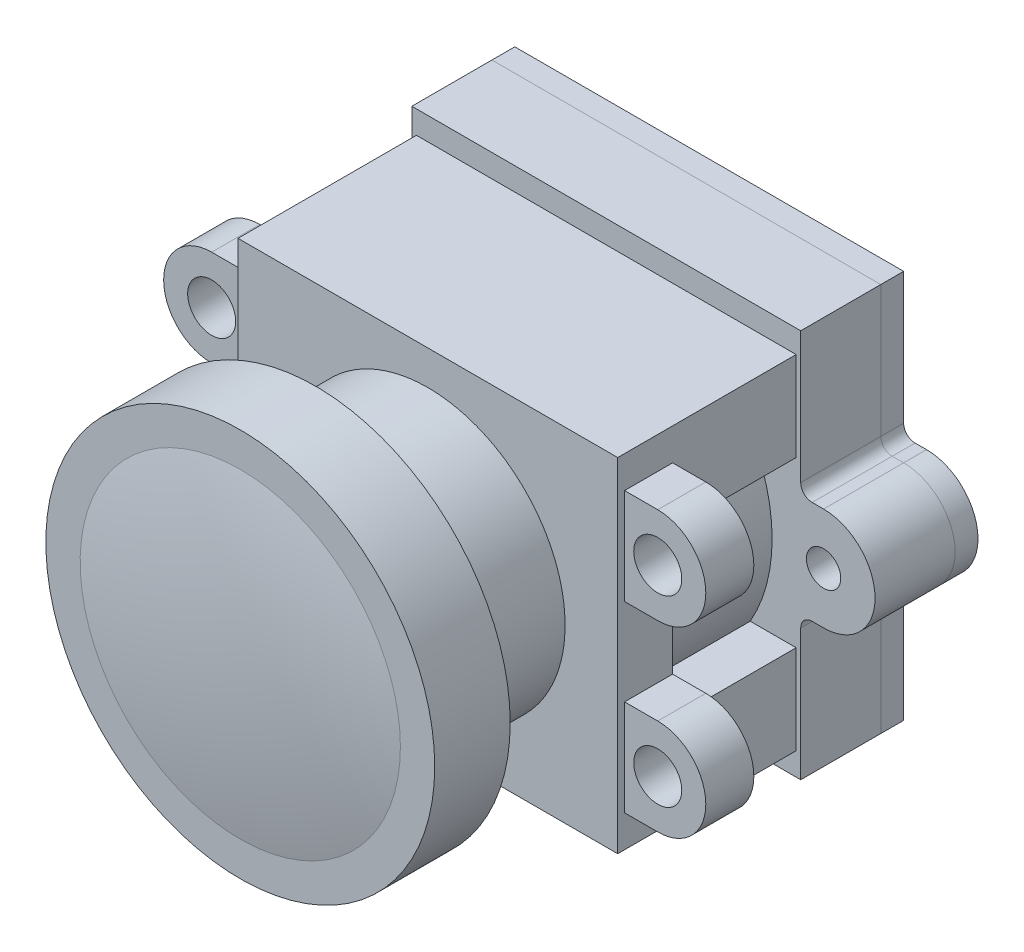
from build123d import *

# Parameters (mm, degrees)
EXTRUDE_START       = -5.1
SKETCH_2_W          = 16.6
SKETCH_2_H          = 15
SKETCH_2_R          = 6
EXTRUDE_1_DEPTH     = 7.8
EXTRUDE_START_2     = -0.3
SKETCH_3_R          = 1.05
EXTRUDE_2_DEPTH     = 2.1
SKETCH_4_R          = 0.75
EXTRUDE_3_DEPTH     = 3.5
SKETCH_5_R          = 0.75
EXTRUDE_4_DEPTH     = 1
CUT_EXTRUDE_1_DEPTH = 5.4


with BuildPart() as part:
    # Эскиз1 → Повернуть1 (revolve)
    with BuildSketch(Plane(origin=(0, 0, 0), x_dir=(0, 0, -1), z_dir=(1, 0, 0)), mode=Mode.PRIVATE) as revolve_1_sk:
        with BuildLine():
            Line((10, 6), (0, 6))
            Line((0, 6), (0, 8.5))
            Line((0, 8.5), (-3.3, 8.5))
            Line((-3.3, 8.5), (-3.3, 7))
            ThreePointArc((-3.3, 7), (-3.824564674, 3.517456467), (-4, 0))
            Line((-4, 0), (0, 0))
            Line((0, 0), (10, 0))
            Line((10, 0), (10, 6))
        make_face()
    revolve(revolve_1_sk.sketch.rotate(Axis((0, 0, 4), (0, 0, -1)), 90), axis=Axis((0, 0, 4), (0, 0, -1)))


with BuildPart() as body_2:
    # Эскиз2 → Бобышка-Вытянуть1 (new body)
    with BuildSketch(Plane(origin=(0, 0, -10), x_dir=(-1, 0, 0), z_dir=(0, 0, -1)).offset(EXTRUDE_START)):
        Rectangle(SKETCH_2_W, SKETCH_2_H)
        Circle(SKETCH_2_R, mode=Mode.SUBTRACT)
    extrude(amount=EXTRUDE_1_DEPTH)

    # Эскиз3 → Бобышка-Вытянуть2 (add)
    # profile 1 of 4: a face of its own
    with BuildSketch(Plane.XY.offset(-4.9).offset(EXTRUDE_START_2)):
        with BuildLine():
            Line((-9.75, 6.1), (-8.3, 6.1))
            Line((-8.3, 6.1), (-8.3, 1.9))
            Line((-8.3, 1.9), (-9.75, 1.9))
            ThreePointArc((-9.75, 1.9), (-11.85, 4), (-9.75, 6.1))
        make_face()
        with Locations((-9.75, 4)):
            Circle(SKETCH_3_R, mode=Mode.SUBTRACT)
    # profile 2 of 4: a face of its own
    with BuildSketch(Plane.XY.offset(-4.9).offset(EXTRUDE_START_2)):
        with BuildLine():
            Line((9.75, 1.9), (8.3, 1.9))
            Line((8.3, 1.9), (8.3, 6.1))
            Line((8.3, 6.1), (9.75, 6.1))
            ThreePointArc((9.75, 6.1), (11.85, 4), (9.75, 1.9))
        make_face()
        with Locations(Location((9.75, 4, 0), (0, 0, 180))):
            Circle(SKETCH_3_R, mode=Mode.SUBTRACT)
    # profile 3 of 4: a face of its own
    with BuildSketch(Plane.XY.offset(-4.9).offset(EXTRUDE_START_2)):
        with BuildLine():
            Line((9.75, -6.1), (8.3, -6.1))
            Line((8.3, -6.1), (8.3, -1.9))
            Line((8.3, -1.9), (9.75, -1.9))
            ThreePointArc((9.75, -1.9), (11.85, -4), (9.75, -6.1))
        make_face()
        with Locations((9.75, -4)):
            Circle(SKETCH_3_R, mode=Mode.SUBTRACT)
    # profile 4 of 4: a face of its own
    with BuildSketch(Plane.XY.offset(-4.9).offset(EXTRUDE_START_2)):
        with BuildLine():
            Line((-9.75, -1.9), (-8.3, -1.9))
            Line((-8.3, -1.9), (-8.3, -6.1))
            Line((-8.3, -6.1), (-9.75, -6.1))
            ThreePointArc((-9.75, -6.1), (-11.85, -4), (-9.75, -1.9))
        make_face()
        with Locations(Location((-9.75, -4, 0), (0, 0, 180))):
            Circle(SKETCH_3_R, mode=Mode.SUBTRACT)
    extrude(amount=-EXTRUDE_2_DEPTH)

    # Эскиз4 → Бобышка-Вытянуть3 (add)
    with BuildSketch(Plane(origin=(0, 0, -12.7), x_dir=(-1, 0, 0), z_dir=(0, 0, -1))):
        with BuildLine():
            Line((-8.5, -8.5), (8.5, -8.5))
            Line((8.5, -8.5), (8.5, -2.75))
            ThreePointArc((8.5, -2.75), (8.646446609, -2.396446609), (9, -2.25))
            Line((9, -2.25), (9.5, -2.25))
            ThreePointArc((9.5, -2.25), (11.75, 0), (9.5, 2.25))
            Line((9.5, 2.25), (9, 2.25))
            ThreePointArc((9, 2.25), (8.646446609, 2.396446609), (8.5, 2.75))
            Line((8.5, 2.75), (8.5, 8.5))
            Line((8.5, 8.5), (-8.5, 8.5))
            Line((-8.5, 8.5), (-8.5, 2.75))
            ThreePointArc((-8.5, 2.75), (-8.646446609, 2.396446609), (-9, 2.25))
            Line((-9, 2.25), (-9.5, 2.25))
            ThreePointArc((-9.5, 2.25), (-11.75, 0), (-9.5, -2.25))
            Line((-9.5, -2.25), (-9, -2.25))
            ThreePointArc((-9, -2.25), (-8.646446609, -2.396446609), (-8.5, -2.75))
            Line((-8.5, -2.75), (-8.5, -8.5))
        make_face()
        with Locations((-9.5, 0)):
            Circle(SKETCH_4_R, mode=Mode.SUBTRACT)
        with Locations(Location((9.5, 0, 0), (0, 0, 180))):
            Circle(SKETCH_4_R, mode=Mode.SUBTRACT)
    extrude(amount=EXTRUDE_3_DEPTH)

    # Эскиз7 → Вырез-Вытянуть1 (cut)
    with BuildSketch(Plane.XY.offset(-12.7)):
        with BuildLine():
            Line((-8.3, -3.6), (-8.3, 3.6))
            Line((-8.3, 3.6), (-6.293051724, 3.6))
            ThreePointArc((-6.293051724, 3.6), (-7.25, 0), (-6.293051724, -3.6))
            Line((-6.293051724, -3.6), (-8.3, -3.6))
        make_face()
        with BuildLine():
            Line((8.3, 3.6), (6.293051724, 3.6))
            ThreePointArc((6.293051724, 3.6), (7.25, 0), (6.293051724, -3.6))
            Line((6.293051724, -3.6), (8.3, -3.6))
            Line((8.3, -3.6), (8.3, 3.6))
        make_face()
    extrude(amount=CUT_EXTRUDE_1_DEPTH, mode=Mode.SUBTRACT)


with BuildPart() as body_3:
    # Эскиз5 → Бобышка-Вытянуть4 (new body)
    with BuildSketch(Plane(origin=(0, 0, -16.2), x_dir=(-1, 0, 0), z_dir=(0, 0, -1))):
        with BuildLine():
            Line((8.5, 2.75), (8.5, 8.5))
            Line((8.5, 8.5), (-8.5, 8.5))
            Line((-8.5, 8.5), (-8.5, 2.75))
            ThreePointArc((-8.5, 2.75), (-8.646446609, 2.396446609), (-9, 2.25))
            Line((-9, 2.25), (-9.5, 2.25))
            ThreePointArc((-9.5, 2.25), (-11.75, 0), (-9.5, -2.25))
            Line((-9.5, -2.25), (-9, -2.25))
            ThreePointArc((-9, -2.25), (-8.646446609, -2.396446609), (-8.5, -2.75))
            Line((-8.5, -2.75), (-8.5, -8.5))
            Line((-8.5, -8.5), (8.5, -8.5))
            Line((8.5, -8.5), (8.5, -2.75))
            ThreePointArc((8.5, -2.75), (8.646446609, -2.396446609), (9, -2.25))
            Line((9, -2.25), (9.5, -2.25))
            ThreePointArc((9.5, -2.25), (11.75, 0), (9.5, 2.25))
            Line((9.5, 2.25), (9, 2.25))
            ThreePointArc((9, 2.25), (8.646446609, 2.396446609), (8.5, 2.75))
        make_face()
        with Locations((9.5, 0)):
            Circle(SKETCH_5_R, mode=Mode.SUBTRACT)
        with Locations((-9.5, 0)):
            Circle(SKETCH_5_R, mode=Mode.SUBTRACT)
    extrude(amount=EXTRUDE_4_DEPTH)


solid = Compound([part.part, body_2.part, body_3.part])
